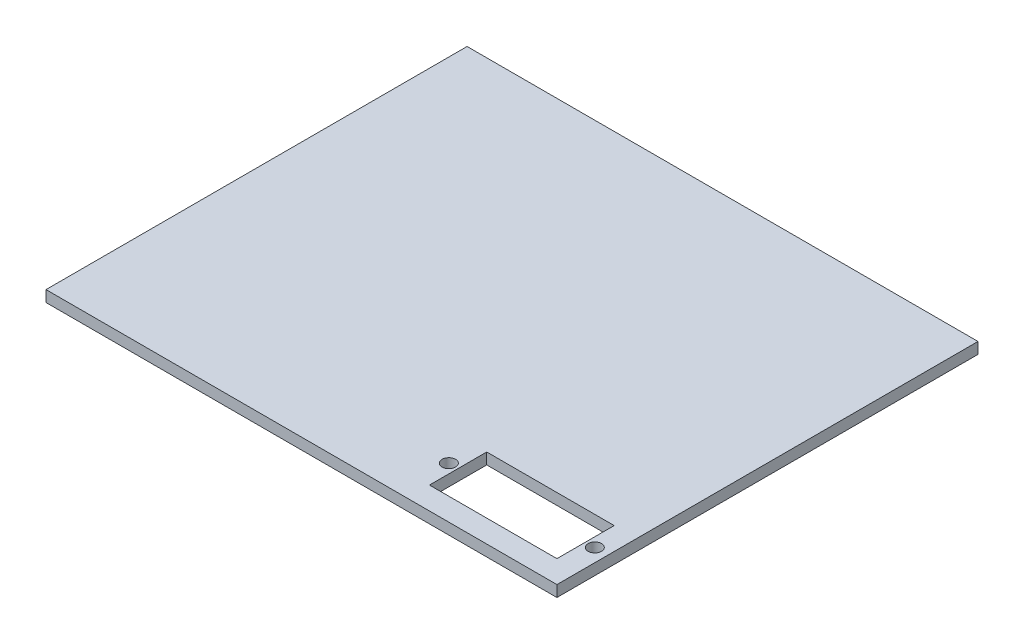
from build123d import *

# Parameters (mm, degrees)
SKETCH_1_W          = 91
SKETCH_1_H          = 75
EXTRUDE_1_DEPTH     = 2
SKETCH_2_R          = 1.2
SKETCH_2_W          = 22.7
SKETCH_2_H          = 10.2
CUT_EXTRUDE_1_DEPTH = 2


with BuildPart() as part:
    # 草图1 → 凸台-拉伸1 (new body)
    with BuildSketch(Plane(origin=(0, 0, 0), x_dir=(1, 0, 0), z_dir=(0, 1, 0))):
        Rectangle(SKETCH_1_W, SKETCH_1_H)
    extrude(amount=EXTRUDE_1_DEPTH)

    # 草图2 → 切除-拉伸1 (cut)
    with BuildSketch(Plane(origin=(0, 2, 0), x_dir=(1, 0, 0), z_dir=(0, 1, 0))):
        with Locations(Location((17.15, -28.4, 0), (0, 0, 270))):
            Circle(SKETCH_2_R)
        with Locations(Location((43.15, -28.4, 0), (0, 0, 90))):
            Circle(SKETCH_2_R)
        with Locations((30.15, -28.4)):
            Rectangle(SKETCH_2_W, SKETCH_2_H)
    extrude(amount=-CUT_EXTRUDE_1_DEPTH, mode=Mode.SUBTRACT)


solid = part.part
